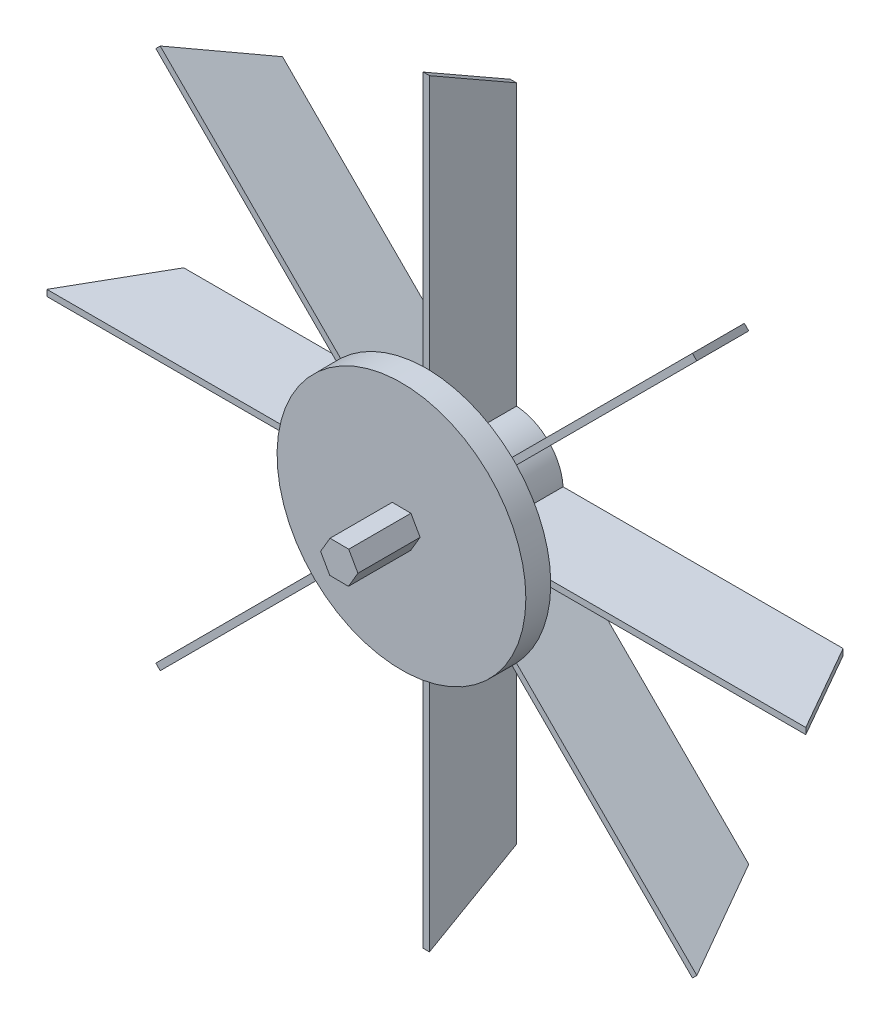
from build123d import *

# Parameters (mm, degrees)
BOSS_EXTRUDE1_DEPTH = 5
SKETCH2_R           = 10
BOSS_EXTRUDE2_DEPTH = 2
SKETCH4_R           = 4
SKETCH4_R_2         = 3
BOSS_EXTRUDE3_DEPTH = 7
BOSS_EXTRUDE5_DEPTH = 0.25
CIRPATTERN1_COUNT   = 8
BOSS_EXTRUDE6_DEPTH = 2


with BuildPart() as part:
    # Sketch1 → Boss-Extrude1 (new body)
    with BuildSketch(Plane.XY):
        Polygon((-0.738715324, 1.305488288), (-1.499943684, 0.012997907), (-0.76122836, -1.292490381), (0.738715324, -1.305488288), (1.499943684, -0.012997907), (0.76122836, 1.292490381), align=None)
    extrude(amount=BOSS_EXTRUDE1_DEPTH)

    # Sketch2 → Boss-Extrude2 (add)
    with BuildSketch(Plane.XY):
        Circle(SKETCH2_R)
    extrude(amount=BOSS_EXTRUDE2_DEPTH)

    # Sketch4 → Boss-Extrude3 (add)
    with BuildSketch(Plane.XY):
        Circle(SKETCH4_R)
        Circle(SKETCH4_R_2, mode=Mode.SUBTRACT)
    extrude(amount=-BOSS_EXTRUDE3_DEPTH)

    # Sketch7 → Boss-Extrude5 (add, symmetric)
    with BuildSketch(Plane(origin=(0, 0, 0), x_dir=(0, 0, -1), z_dir=(1, 0, 0))):
        Polygon((7, 3.5), (0, 3.5), (0, 30.5), (7, 26.5), align=None)
    boss_extrude5 = extrude(amount=BOSS_EXTRUDE5_DEPTH, both=True)

    # CirPattern1: Boss-Extrude5 ×8 about axis
    cirpattern1_axis = Axis((0, 0, 0), (0, 0, 1))
    for i in range(1, CIRPATTERN1_COUNT):
        add(boss_extrude5.rotate(cirpattern1_axis, i * 360 / CIRPATTERN1_COUNT))

    # Sketch9 → Boss-Extrude6 (add)
    with BuildSketch(Plane(origin=(-1.499943684, 0.012997907, 5), x_dir=(-1, 0, 0), z_dir=(0, 0, -1))):
        Polygon((-0.76122836, 1.292490381), (-2.261172044, 1.279492473), (-2.999887367, -0.025995815), (-2.238659008, -1.318486195), (-0.738715324, -1.305488288), (0, 0), align=None)
    extrude(amount=-BOSS_EXTRUDE6_DEPTH)


solid = part.part
